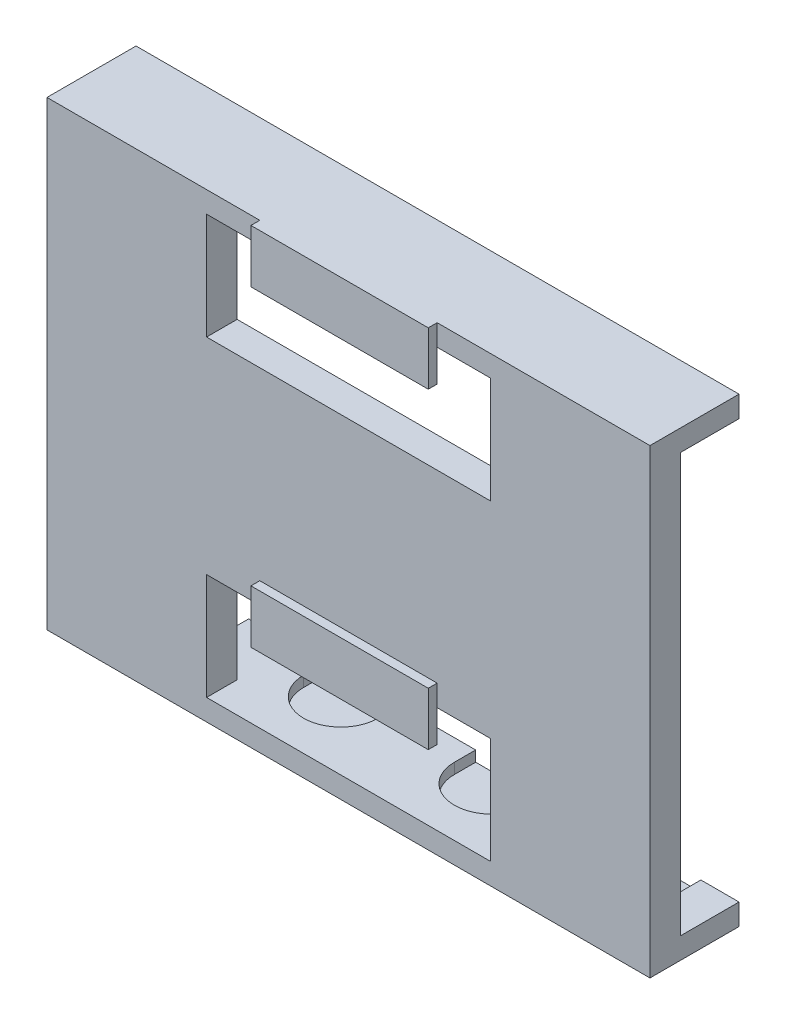
from build123d import *

# Parameters (mm, degrees)
BOSS_EXTRUDE1_DEPTH = 3
BOSS_EXTRUDE2_DEPTH = 3
LPATTERN1_COUNT     = 4
LPATTERN1_PITCH     = 42.5
SKETCH2_W           = 170
SKETCH2_H           = 8.612566395
BOSS_EXTRUDE3_DEPTH = 118
SKETCH4_W           = 2.5
SKETCH4_H           = 15
BOSS_EXTRUDE4_DEPTH = 25
SKETCH4_3_W         = 8.612566395
SKETCH4_3_H         = 30
CUT_EXTRUDE1_DEPTH  = 40


with BuildPart() as part:
    # Sketch1 → Boss-Extrude1 (new body)
    with BuildSketch(Plane(origin=(0, 0, 0), x_dir=(1, 0, 0), z_dir=(0, 1, 0))):
        with BuildLine():
            Line((-21.25, 0), (0, 0))
            Line((0, 0), (0, 8.612566395))
            ThreePointArc((0, 8.612566395), (-7.424621202, 11.687945192), (-10.5, 19.112566395))
            Line((-10.5, 19.112566395), (-10.5, 25.112566395))
            Line((-10.5, 25.112566395), (-21.25, 25.112566395))
            Line((-21.25, 25.112566395), (-21.25, 0))
        make_face()
        with BuildLine():
            Line((0, 8.612566395), (0, 0))
            Line((0, 0), (21.25, 0))
            Line((21.25, 0), (21.25, 25.112566395))
            Line((21.25, 25.112566395), (10.5, 25.112566395))
            Line((10.5, 25.112566395), (10.5, 19.112566395))
            ThreePointArc((10.5, 19.112566395), (7.424621202, 11.687945192), (0, 8.612566395))
        make_face()
        with BuildLine():
            ThreePointArc((-10.5, 19.112566395), (-7.424621202, 11.687945192), (0, 8.612566395))
            Line((0, 8.612566395), (0, 25.112566395))
            Line((0, 25.112566395), (-10.5, 25.112566395))
            Line((-10.5, 25.112566395), (-10.5, 19.112566395))
        make_face()
        with BuildLine():
            Line((0, 25.112566395), (0, 8.612566395))
            ThreePointArc((0, 8.612566395), (7.424621202, 11.687945192), (10.5, 19.112566395))
            Line((10.5, 19.112566395), (10.5, 25.112566395))
            Line((10.5, 25.112566395), (0, 25.112566395))
        make_face()
    boss_extrude1 = extrude(amount=BOSS_EXTRUDE1_DEPTH)

    # Sketch1<3> → Boss-Extrude2 (add)
    with BuildSketch(Plane(origin=(0, 0, 0), x_dir=(1, 0, 0), z_dir=(0, 1, 0))):
        with BuildLine():
            Line((-21.25, 0), (0, 0))
            Line((0, 0), (0, 8.612566395))
            ThreePointArc((0, 8.612566395), (-7.424621202, 11.687945192), (-10.5, 19.112566395))
            Line((-10.5, 19.112566395), (-10.5, 25.112566395))
            Line((-10.5, 25.112566395), (-21.25, 25.112566395))
            Line((-21.25, 25.112566395), (-21.25, 0))
        make_face()
        with BuildLine():
            Line((0, 8.612566395), (0, 0))
            Line((0, 0), (21.25, 0))
            Line((21.25, 0), (21.25, 25.112566395))
            Line((21.25, 25.112566395), (10.5, 25.112566395))
            Line((10.5, 25.112566395), (10.5, 19.112566395))
            ThreePointArc((10.5, 19.112566395), (7.424621202, 11.687945192), (0, 8.612566395))
        make_face()
    boss_extrude2 = extrude(amount=-BOSS_EXTRUDE2_DEPTH)

    # LPattern1: Boss-Extrude1, Boss-Extrude2 ×4
    with Locations(*[(i * LPATTERN1_PITCH, 0, 0) for i in range(1, LPATTERN1_COUNT)]):
        add(boss_extrude1)
        add(boss_extrude2)

    # Sketch2 → Boss-Extrude3 (add)
    with BuildSketch(Plane(origin=(0, -3, 0), x_dir=(-1, 0, 0), z_dir=(0, -1, 0))):
        with Locations((-63.75, 4.306283197)):
            Rectangle(SKETCH2_W, SKETCH2_H)
    extrude(amount=BOSS_EXTRUDE3_DEPTH)

    # Mirror2: part across plane


with BuildPart() as part_1:
    add(part.part)
    add(part.part.mirror(Plane(origin=(0, -62, 0), x_dir=(0, 0, 1), z_dir=(0, -1, 0))))

    # Sketch4 → Boss-Extrude4 (add, symmetric)
    with BuildSketch(Plane.ZY.offset(-63.75)):
        with Locations((1.25, -4.5)):
            Rectangle(SKETCH4_W, SKETCH4_H)
        Polygon((0, -91), (0, -100), (2.5, -100), (2.5, -85), (0, -85), align=None)
    extrude(amount=BOSS_EXTRUDE4_DEPTH, both=True)

    # Sketch4<3> → Cut-Extrude1 (cut, symmetric)
    with BuildSketch(Plane.ZY.offset(-63.75)):
        Polygon((0, -12), (0, -3), (-8.612566395, -3), (-8.612566395, -33), (0, -33), align=None)
        with Locations((-4.306283197, -106)):
            Rectangle(SKETCH4_3_W, SKETCH4_3_H)
    extrude(amount=CUT_EXTRUDE1_DEPTH, both=True, mode=Mode.SUBTRACT)


solid = part_1.part
